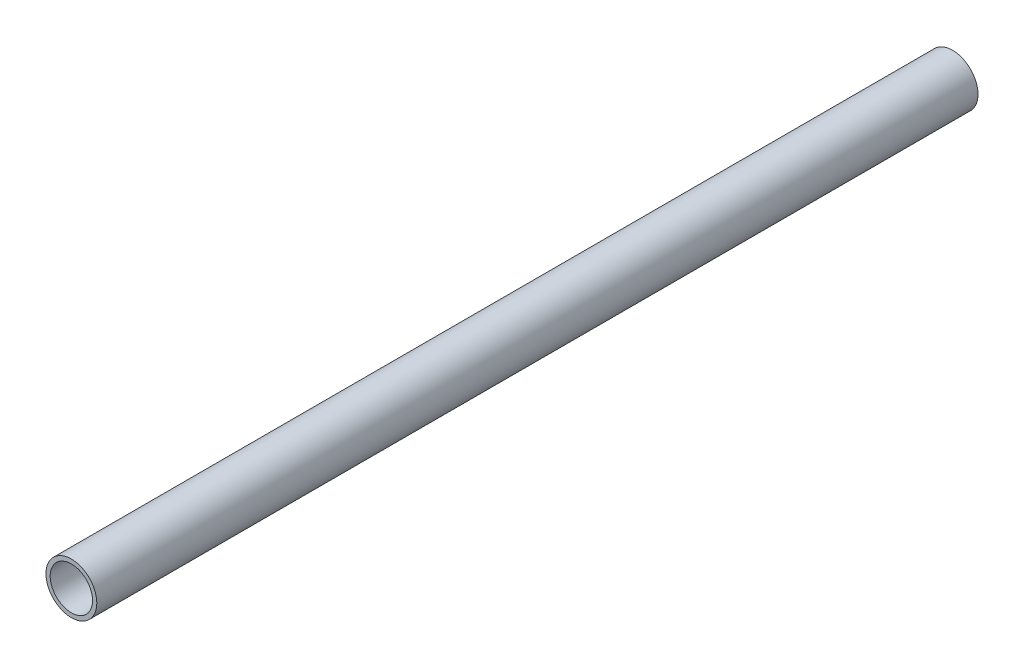
from build123d import *

# Parameters (mm, degrees)
SKETCH1_R           = 38.1
SKETCH1_R_2         = 31.75
BOSS_EXTRUDE1_DEPTH = 660.4


with BuildPart() as part:
    # Sketch1 → Boss-Extrude1 (new, symmetric)
    with BuildSketch(Plane.XY):
        Circle(SKETCH1_R)
        Circle(SKETCH1_R_2, mode=Mode.SUBTRACT)
    extrude(amount=BOSS_EXTRUDE1_DEPTH, both=True)


solid = part.part
